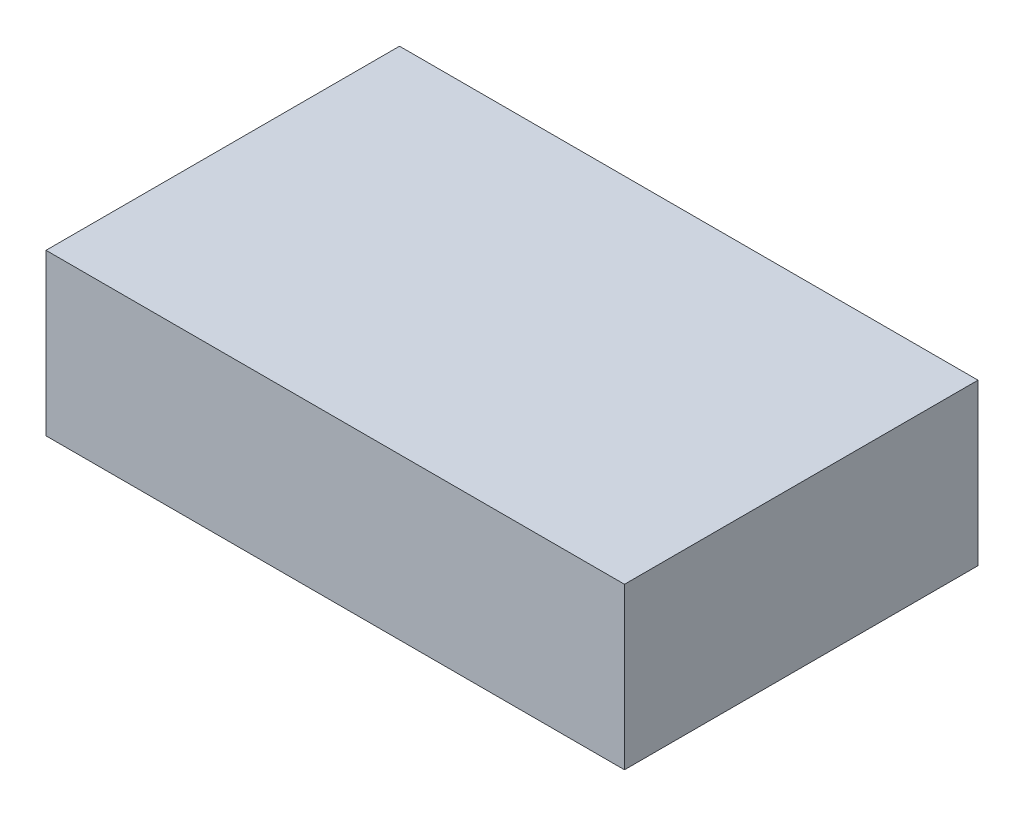
from build123d import *

# Parameters (mm, degrees)
SKETCH1_W           = 36
SKETCH1_H           = 22
BOSS_EXTRUDE1_DEPTH = 10


with BuildPart() as part:
    # Sketch1 → Boss-Extrude1 (new body)
    with BuildSketch(Plane(origin=(0, 0, 0), x_dir=(1, 0, 0), z_dir=(0, 1, 0))):
        with Locations((18, 11)):
            Rectangle(SKETCH1_W, SKETCH1_H)
    extrude(amount=BOSS_EXTRUDE1_DEPTH)


solid = part.part
